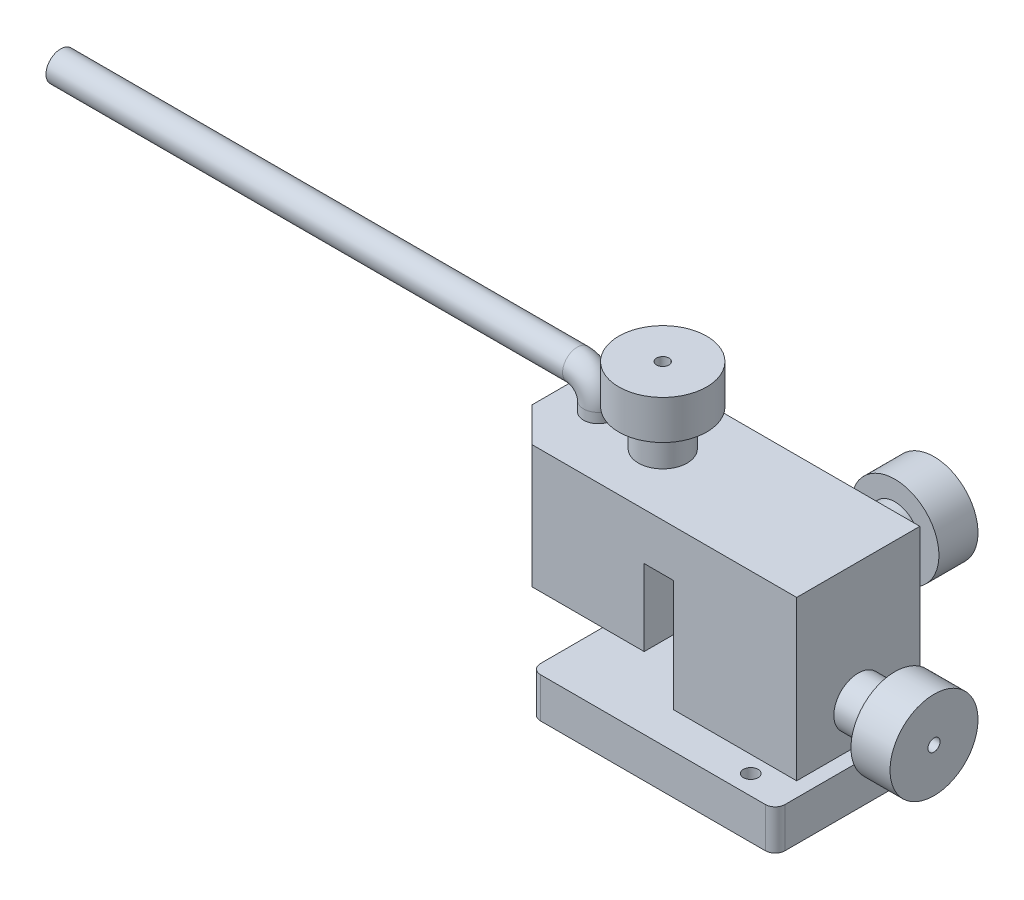
from build123d import *

# Parameters (mm, degrees)
BOSS_EXTRUDE1_DEPTH  = 8.2
SKETCH2_W            = 25.2
SKETCH2_H            = 25.2
BOSS_EXTRUDE2_DEPTH  = 32.5
SKETCH3_W            = 25.2
SKETCH3_H            = 9.6
BOSS_EXTRUDE3_DEPTH  = 6
SKETCH4_W            = 25.2
SKETCH4_H            = 25.2
BOSS_EXTRUDE4_DEPTH  = 30
CHAMFER1_SIZE        = 7
SKETCH5_R            = 5
BOSS_EXTRUDE5_DEPTH  = 7.5
SKETCH6_R            = 9
BOSS_EXTRUDE6_DEPTH  = 8
SKETCH7_R            = 1.25
CUT_EXTRUDE1_DEPTH   = 4
SKETCH8_R            = 5
BOSS_EXTRUDE7_DEPTH  = 7.5
SKETCH9_R            = 9
BOSS_EXTRUDE8_DEPTH  = 8
SKETCH10_R           = 1.25
CUT_EXTRUDE2_DEPTH   = 4
SKETCH11_R           = 5
BOSS_EXTRUDE9_DEPTH  = 7.5
SKETCH12_R           = 9
BOSS_EXTRUDE10_DEPTH = 8
SKETCH13_R           = 1.25
CUT_EXTRUDE3_DEPTH   = 4
SKETCH15_R           = 3
CUT_EXTRUDE4_REACH   = 139.748
SKETCH16_R           = 1.5


with BuildPart() as part:
    # Sketch1 → Boss-Extrude1 (new body)
    with BuildSketch(Plane(origin=(0, 0, 0), x_dir=(1, 0, 0), z_dir=(0, 1, 0))):
        with BuildLine():
            Line((2, 0), (48, 0))
            ThreePointArc((48, 0), (49.414213562, 0.585786438), (50, 2))
            Line((50, 2), (50, 38))
            ThreePointArc((50, 38), (49.414213562, 39.414213562), (48, 40))
            Line((48, 40), (2, 40))
            ThreePointArc((2, 40), (0.585786438, 39.414213562), (0, 38))
            Line((0, 38), (0, 2))
            ThreePointArc((0, 2), (0.585786438, 0.585786438), (2, 0))
        make_face()
    extrude(amount=BOSS_EXTRUDE1_DEPTH)

    # Sketch2 → Boss-Extrude2 (add)
    with BuildSketch(Plane(origin=(0, 8.2, 0), x_dir=(1, 0, 0), z_dir=(0, 1, 0))):
        with Locations((34.4, 20)):
            Rectangle(SKETCH2_W, SKETCH2_H)
    extrude(amount=BOSS_EXTRUDE2_DEPTH)

    # Sketch3 → Boss-Extrude3 (add)
    with BuildSketch(Plane.ZY.offset(-21.8)):
        with Locations((-20, 35.9)):
            Rectangle(SKETCH3_W, SKETCH3_H)
    extrude(amount=BOSS_EXTRUDE3_DEPTH)

    # Sketch4 → Boss-Extrude4 (add)
    with BuildSketch(Plane.ZY.offset(-15.8)):
        with Locations((-20, 28.1)):
            Rectangle(SKETCH4_W, SKETCH4_H)
    extrude(amount=BOSS_EXTRUDE4_DEPTH)

    # Chamfer1
    chamfer1_edges = [part.edges().sort_by_distance(p)[0] for p in [
        (-14.2, 28.1, -32.6),
        (-14.2, 28.1, -7.4),
    ]]
    chamfer(chamfer1_edges, length=CHAMFER1_SIZE)

    # Sketch5 → Boss-Extrude5 (add)
    with BuildSketch(Plane(origin=(47, 0, 0), x_dir=(0, 0, -1), z_dir=(1, 0, 0))):
        with Locations(Location((20, 16, 0), (0, 0, 180))):
            Circle(SKETCH5_R)
    extrude(amount=BOSS_EXTRUDE5_DEPTH)

    # Sketch6 → Boss-Extrude6 (add)
    with BuildSketch(Plane(origin=(54.5, 0, 0), x_dir=(0, 0, -1), z_dir=(1, 0, 0))):
        with Locations((20, 16)):
            Circle(SKETCH6_R)
    extrude(amount=BOSS_EXTRUDE6_DEPTH)

    # Sketch7 → Cut-Extrude1 (cut)
    with BuildSketch(Plane(origin=(62.5, 0, 0), x_dir=(0, 0, -1), z_dir=(1, 0, 0))):
        with Locations((20, 16)):
            Circle(SKETCH7_R)
    extrude(amount=-CUT_EXTRUDE1_DEPTH, mode=Mode.SUBTRACT)

    # Sketch8 → Boss-Extrude7 (add)
    with BuildSketch(Plane(origin=(0, 0, -32.6), x_dir=(-1, 0, 0), z_dir=(0, 0, -1))):
        with Locations(Location((-34.4, 30, 0), (0, 0, 180))):
            Circle(SKETCH8_R)
    extrude(amount=BOSS_EXTRUDE7_DEPTH)

    # Sketch9 → Boss-Extrude8 (add)
    with BuildSketch(Plane(origin=(0, 0, -40.1), x_dir=(-1, 0, 0), z_dir=(0, 0, -1))):
        with Locations((-34.4, 30)):
            Circle(SKETCH9_R)
    extrude(amount=BOSS_EXTRUDE8_DEPTH)

    # Sketch10 → Cut-Extrude2 (cut)
    with BuildSketch(Plane(origin=(0, 0, -48.1), x_dir=(-1, 0, 0), z_dir=(0, 0, -1))):
        with Locations((-34.4, 30)):
            Circle(SKETCH10_R)
    extrude(amount=-CUT_EXTRUDE2_DEPTH, mode=Mode.SUBTRACT)

    # Sketch11 → Boss-Extrude9 (add)
    with BuildSketch(Plane(origin=(0, 40.7, 0), x_dir=(1, 0, 0), z_dir=(0, 1, 0))):
        with Locations(Location((7, 20, 0), (0, 0, 270))):
            Circle(SKETCH11_R)
    extrude(amount=BOSS_EXTRUDE9_DEPTH)

    # Sketch12 → Boss-Extrude10 (add)
    with BuildSketch(Plane(origin=(0, 48.2, 0), x_dir=(1, 0, 0), z_dir=(0, 1, 0))):
        with Locations(Location((7, 20, 0), (0, 0, 270))):
            Circle(SKETCH12_R)
    extrude(amount=BOSS_EXTRUDE10_DEPTH)

    # Sketch13 → Cut-Extrude3 (cut)
    with BuildSketch(Plane(origin=(0, 56.2, 0), x_dir=(1, 0, 0), z_dir=(0, 1, 0))):
        with Locations(Location((7, 20, 0), (0, 0, 270))):
            Circle(SKETCH13_R)
    extrude(amount=-CUT_EXTRUDE3_DEPTH, mode=Mode.SUBTRACT)

    # Sweep1: sweep along a path in Sketch14
    with BuildLine(Plane.XY.offset(-20)) as sweep1_path:
        Line((-6.2, 40.7), (-6.2, 42.7))
        ThreePointArc((-6.2, 42.7), (-7.459440841, 45.740559159), (-10.5, 47))
        Line((-10.5, 47), (-116.2, 47))
    # Sketch15 → Sweep1 (sweep)
    with BuildSketch(Plane(origin=(-116.2, 0, 0), x_dir=(0, 0, -1), z_dir=(1, 0, 0))):
        with Locations((20, 47)):
            Circle(SKETCH15_R)
    sweep(path=sweep1_path.line)

    # Sketch16 → Cut-Extrude4 (cut, up to next)
    with BuildSketch(Plane.XZ, mode=Mode.PRIVATE) as cut_extrude4_sk1:
        with Locations(Location((41, -4, 0), (0, 0, 270))):
            Circle(SKETCH16_R)
    cut_extrude4_tool1 = extrude(cut_extrude4_sk1.sketch, amount=-CUT_EXTRUDE4_REACH, mode=Mode.PRIVATE) & part.part
    # Sketch16 → Cut-Extrude4 (cut, up to next)
    with BuildSketch(Plane.XZ, mode=Mode.PRIVATE) as cut_extrude4_sk2:
        with Locations(Location((41, -36, 0), (0, 0, 270))):
            Circle(SKETCH16_R)
    cut_extrude4_tool2 = extrude(cut_extrude4_sk2.sketch, amount=-CUT_EXTRUDE4_REACH, mode=Mode.PRIVATE) & part.part
    add(cut_extrude4_tool1.solids().sort_by_distance((41, 0, -4))[0], mode=Mode.SUBTRACT)
    add(cut_extrude4_tool2.solids().sort_by_distance((41, 0, -36))[0], mode=Mode.SUBTRACT)


solid = part.part
